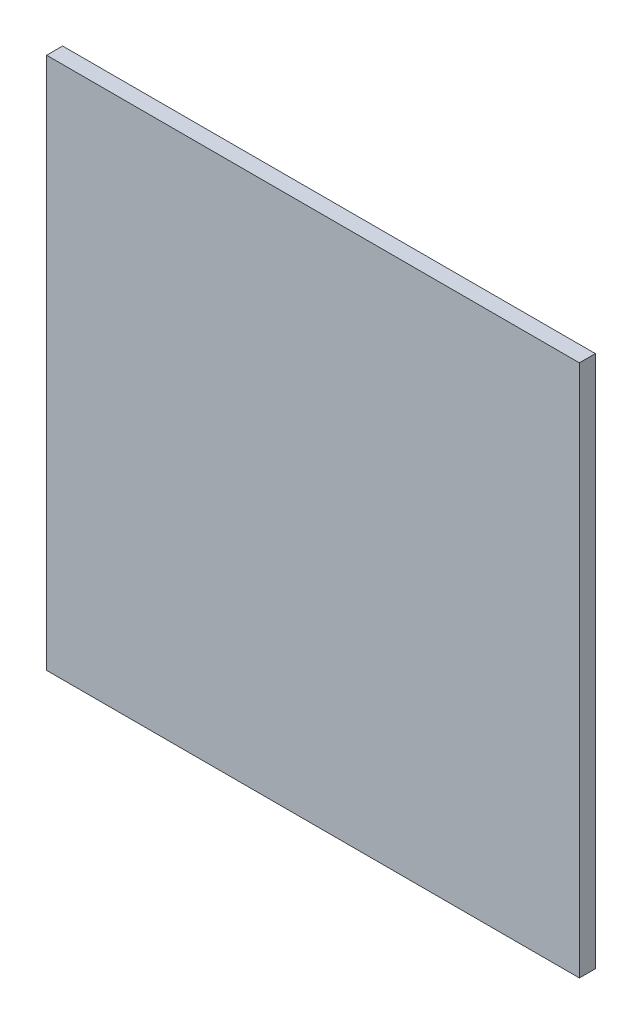
from build123d import *

# Parameters (mm, degrees)
ESQUISSE1_W        = 100
ESQUISSE1_H        = 100
BOSS_EXTRU_1_DEPTH = 3


with BuildPart() as part:
    # Esquisse1 → Boss.-Extru.1 (new body)
    with BuildSketch(Plane.XY):
        Rectangle(ESQUISSE1_W, ESQUISSE1_H)
    extrude(amount=BOSS_EXTRU_1_DEPTH)


solid = part.part
